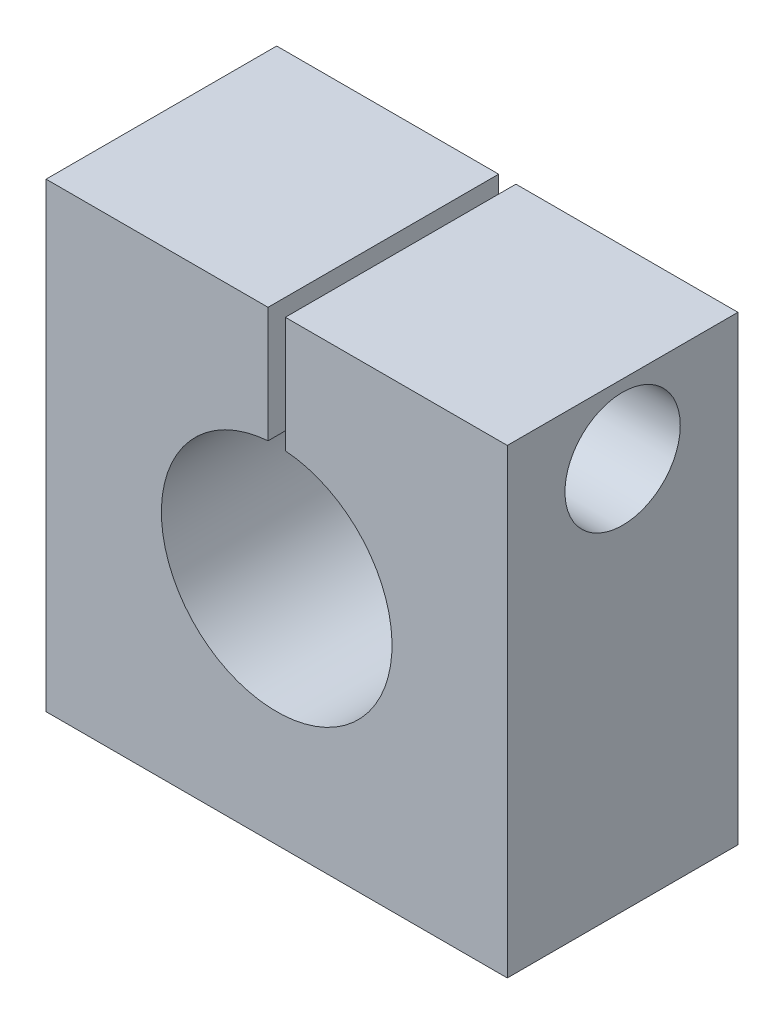
from build123d import *

# Parameters (mm, degrees)
CROQUIS1_R              = 3
SALIENTE_EXTRUIR1_DEPTH = 20
CROQUIS2_R              = 3
CORTAR_EXTRUIR1_DEPTH   = 30
CROQUIS3_R              = 5
CORTAR_EXTRUIR2_DEPTH   = 10
CROQUIS4_W              = 40
CROQUIS4_H              = 50
CORTAR_EXTRUIR3_DEPTH   = 54.150729064
CROQUIS5_R              = 4
CORTAR_EXTRUIR4_DEPTH   = 10


with BuildPart() as part:
    # Croquis1 → Saliente-Extruir1 (new body)
    with BuildSketch(Plane.XY):
        with BuildLine():
            Line((-0.75, 34.971835338), (-0.75, 45))
            Line((-0.75, 45), (-20, 45))
            Line((-20, 45), (-20, -45))
            Line((-20, -45), (20, -45))
            Line((20, -45), (20, 45))
            Line((20, 45), (0.75, 45))
            Line((0.75, 45), (0.75, 34.971835338))
            ThreePointArc((0.75, 34.971835338), (0, 15), (-0.75, 34.971835338))
        make_face()
        with Locations((-10, -35)):
            Circle(CROQUIS1_R, mode=Mode.SUBTRACT)
        with Locations((10, -35)):
            Circle(CROQUIS1_R, mode=Mode.SUBTRACT)
    extrude(amount=SALIENTE_EXTRUIR1_DEPTH)

    # Croquis2 → Cortar-Extruir1 (cut)
    with BuildSketch(Plane(origin=(20, 0, 0), x_dir=(0, 0, -1), z_dir=(1, 0, 0))):
        with Locations((-10, 39)):
            Circle(CROQUIS2_R)
    extrude(amount=-CORTAR_EXTRUIR1_DEPTH, mode=Mode.SUBTRACT)

    # Croquis3 → Cortar-Extruir2 (cut)
    with BuildSketch(Plane(origin=(20, 0, 0), x_dir=(0, 0, -1), z_dir=(1, 0, 0))):
        with Locations((-10, 39)):
            Circle(CROQUIS3_R)
    extrude(amount=-CORTAR_EXTRUIR2_DEPTH, mode=Mode.SUBTRACT)

    # Croquis4 → Cortar-Extruir3 (cut, through all)
    with BuildSketch(Plane.XY.offset(20)):
        with Locations((0, -20)):
            Rectangle(CROQUIS4_W, CROQUIS4_H)
    extrude(amount=-CORTAR_EXTRUIR3_DEPTH, mode=Mode.SUBTRACT)

    # Croquis5 → Cortar-Extruir4 (cut)
    with BuildSketch(Plane.XZ.offset(-5)):
        with Locations(Location((-10, 10, 0), (0, 0, 270))):
            Circle(CROQUIS5_R)
        with Locations(Location((10, 10, 0), (0, 0, 270))):
            Circle(CROQUIS5_R)
    extrude(amount=-CORTAR_EXTRUIR4_DEPTH, mode=Mode.SUBTRACT)


solid = part.part
